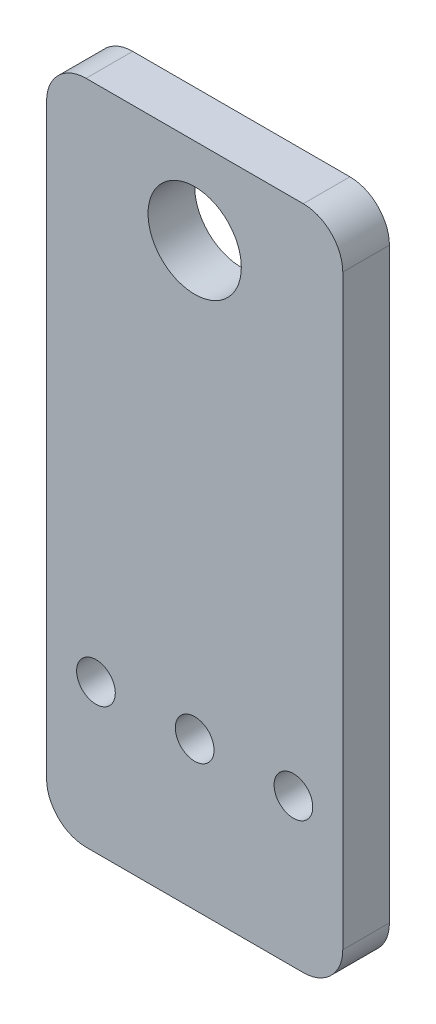
from build123d import *

# Parameters (mm, degrees)
SKETCH1_R           = 2.4892
SKETCH1_R_2         = 6
BOSS_EXTRUDE1_DEPTH = 6


with BuildPart() as part:
    # Sketch1 → Boss-Extrude1 (new body)
    with BuildSketch(Plane.XY):
        with BuildLine():
            Line((-382.27, -19.05), (-354.33, -19.05))
            ThreePointArc((-354.33, -19.05), (-350.737897552, -17.562102448), (-349.25, -13.97))
            Line((-349.25, -13.97), (-349.25, 61.53))
            ThreePointArc((-349.25, 61.53), (-350.737897552, 65.122102448), (-354.33, 66.61))
            Line((-354.33, 66.61), (-382.27, 66.61))
            ThreePointArc((-382.27, 66.61), (-385.862102448, 65.122102448), (-387.35, 61.53))
            Line((-387.35, 61.53), (-387.35, -13.97))
            ThreePointArc((-387.35, -13.97), (-385.862102448, -17.562102448), (-382.27, -19.05))
        make_face()
        with Locations((-368.3, 0)):
            Circle(SKETCH1_R, mode=Mode.SUBTRACT)
        with Locations((-355.6, 0)):
            Circle(SKETCH1_R, mode=Mode.SUBTRACT)
        with Locations((-381, 0)):
            Circle(SKETCH1_R, mode=Mode.SUBTRACT)
        with Locations((-368.3, 55.53)):
            Circle(SKETCH1_R_2, mode=Mode.SUBTRACT)
    extrude(amount=BOSS_EXTRUDE1_DEPTH)


solid = part.part
